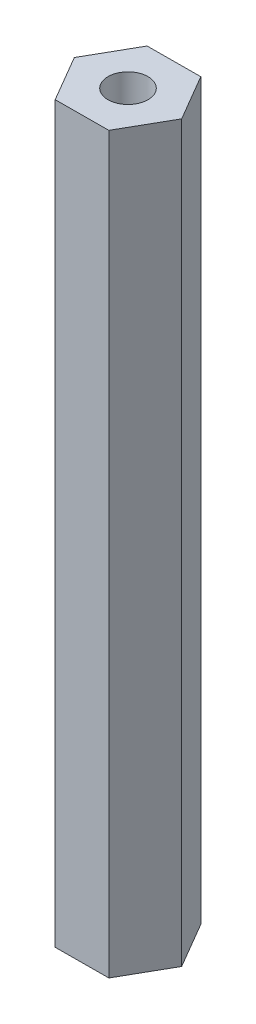
from build123d import *

# Parameters (mm, degrees)
SKETCH1_R           = 1.5
BOSS_EXTRUDE1_DEPTH = 55


with BuildPart() as part:
    # Sketch1 → Boss-Extrude1 (new body)
    with BuildSketch(Plane(origin=(0, 0, 0), x_dir=(1, 0, 0), z_dir=(0, 1, 0))):
        Polygon((-1.981057294, -3.474969352), (2.018883089, -3.453130619), (3.999940383, 0.021838733), (1.981057294, 3.474969352), (-2.018883089, 3.453130619), (-3.999940383, -0.021838733), align=None)
        with Locations(Location((0, 0, 0), (0, 0, 270))):
            Circle(SKETCH1_R, mode=Mode.SUBTRACT)
    extrude(amount=BOSS_EXTRUDE1_DEPTH)


solid = part.part
